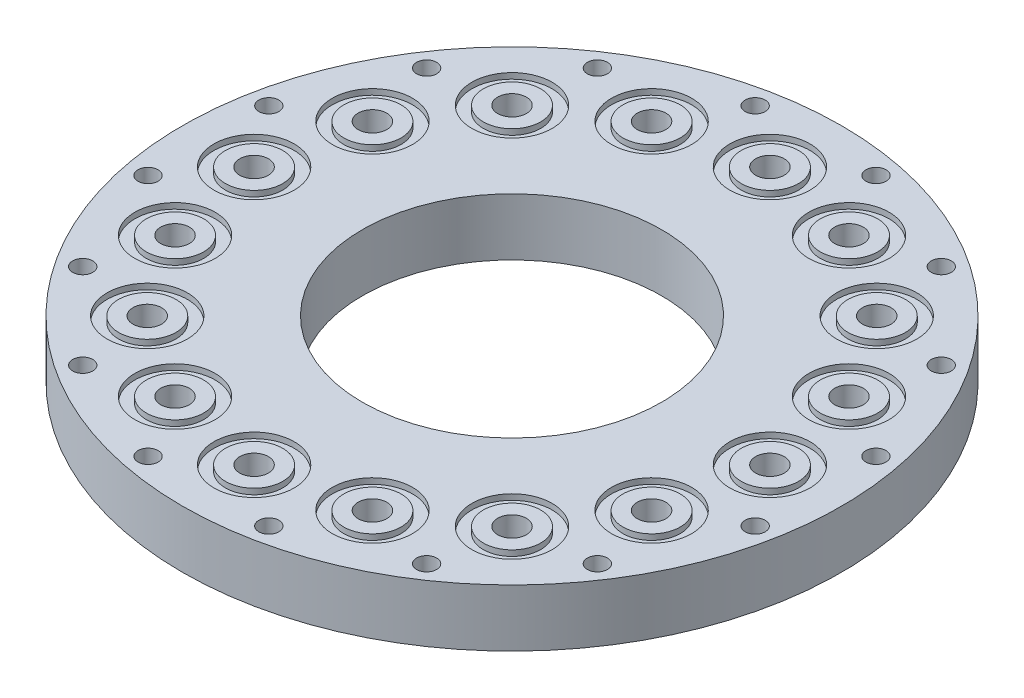
from build123d import *

# Parameters (mm, degrees)
SKETCH1_R           = 57.5
SKETCH1_R_2         = 1.75
SKETCH1_R_3         = 26.1
SKETCH1_R_4         = 2.5
BOSS_EXTRUDE1_DEPTH = 10
SKETCH2_R           = 7
SKETCH2_R_2         = 5
CUT_EXTRUDE1_DEPTH  = 1


with BuildPart() as part:
    # Sketch1 → Boss-Extrude1 (new body)
    with BuildSketch(Plane(origin=(0, 0, 0), x_dir=(1, 0, 0), z_dir=(0, 1, 0))):
        with Locations(Location((0, 0, 0), (0, 0, 270))):
            Circle(SKETCH1_R)
        with Locations(Location((-10.534877389, 52.962405142, 0), (0, 0, 270))):
            Circle(SKETCH1_R_2, mode=Mode.SUBTRACT)
        with Locations(Location((10.534877389, 52.962405142, 0), (0, 0, 270))):
            Circle(SKETCH1_R_2, mode=Mode.SUBTRACT)
        with Locations(Location((30.000792583, 44.899359064, 0), (0, 0, 270))):
            Circle(SKETCH1_R_2, mode=Mode.SUBTRACT)
        with Locations(Location((44.899359064, 30.000792583, 0), (0, 0, 270))):
            Circle(SKETCH1_R_2, mode=Mode.SUBTRACT)
        with Locations(Location((52.962405142, 10.534877389, 0), (0, 0, 270))):
            Circle(SKETCH1_R_2, mode=Mode.SUBTRACT)
        with Locations(Location((52.962405142, -10.534877389, 0), (0, 0, 270))):
            Circle(SKETCH1_R_2, mode=Mode.SUBTRACT)
        with Locations(Location((44.899359064, -30.000792583, 0), (0, 0, 270))):
            Circle(SKETCH1_R_2, mode=Mode.SUBTRACT)
        with Locations(Location((30.000792583, -44.899359064, 0), (0, 0, 270))):
            Circle(SKETCH1_R_2, mode=Mode.SUBTRACT)
        with Locations(Location((10.534877389, -52.962405142, 0), (0, 0, 270))):
            Circle(SKETCH1_R_2, mode=Mode.SUBTRACT)
        with Locations(Location((-10.534877389, -52.962405142, 0), (0, 0, 270))):
            Circle(SKETCH1_R_2, mode=Mode.SUBTRACT)
        with Locations(Location((-30.000792583, -44.899359064, 0), (0, 0, 270))):
            Circle(SKETCH1_R_2, mode=Mode.SUBTRACT)
        with Locations(Location((-44.899359064, -30.000792583, 0), (0, 0, 270))):
            Circle(SKETCH1_R_2, mode=Mode.SUBTRACT)
        with Locations(Location((0, 0, 0), (0, 0, 270))):
            Circle(SKETCH1_R_3, mode=Mode.SUBTRACT)
        with Locations(Location((0, 45, 0), (0, 0, 270))):
            Circle(SKETCH1_R_4, mode=Mode.SUBTRACT)
        with Locations(Location((17.220754456, 41.574578963, 0), (0, 0, 270))):
            Circle(SKETCH1_R_4, mode=Mode.SUBTRACT)
        with Locations(Location((31.819805153, 31.819805153, 0), (0, 0, 270))):
            Circle(SKETCH1_R_4, mode=Mode.SUBTRACT)
        with Locations(Location((41.574578963, 17.220754456, 0), (0, 0, 270))):
            Circle(SKETCH1_R_4, mode=Mode.SUBTRACT)
        with Locations(Location((45, 0, 0), (0, 0, 270))):
            Circle(SKETCH1_R_4, mode=Mode.SUBTRACT)
        with Locations(Location((41.574578963, -17.220754456, 0), (0, 0, 270))):
            Circle(SKETCH1_R_4, mode=Mode.SUBTRACT)
        with Locations(Location((31.819805153, -31.819805153, 0), (0, 0, 270))):
            Circle(SKETCH1_R_4, mode=Mode.SUBTRACT)
        with Locations(Location((17.220754456, -41.574578963, 0), (0, 0, 270))):
            Circle(SKETCH1_R_4, mode=Mode.SUBTRACT)
        with Locations(Location((0, -45, 0), (0, 0, 270))):
            Circle(SKETCH1_R_4, mode=Mode.SUBTRACT)
        with Locations(Location((-17.220754456, -41.574578963, 0), (0, 0, 270))):
            Circle(SKETCH1_R_4, mode=Mode.SUBTRACT)
        with Locations(Location((-31.819805153, -31.819805153, 0), (0, 0, 270))):
            Circle(SKETCH1_R_4, mode=Mode.SUBTRACT)
        with Locations(Location((-41.574578963, -17.220754456, 0), (0, 0, 270))):
            Circle(SKETCH1_R_4, mode=Mode.SUBTRACT)
        with Locations(Location((-45, 0, 0), (0, 0, 270))):
            Circle(SKETCH1_R_4, mode=Mode.SUBTRACT)
        with Locations(Location((-41.574578963, 17.220754456, 0), (0, 0, 270))):
            Circle(SKETCH1_R_4, mode=Mode.SUBTRACT)
        with Locations(Location((-31.819805153, 31.819805153, 0), (0, 0, 270))):
            Circle(SKETCH1_R_4, mode=Mode.SUBTRACT)
        with Locations(Location((-17.220754456, 41.574578963, 0), (0, 0, 270))):
            Circle(SKETCH1_R_4, mode=Mode.SUBTRACT)
        with Locations(Location((-52.962405142, -10.534877389, 0), (0, 0, 270))):
            Circle(SKETCH1_R_2, mode=Mode.SUBTRACT)
        with Locations(Location((-52.962405142, 10.534877389, 0), (0, 0, 270))):
            Circle(SKETCH1_R_2, mode=Mode.SUBTRACT)
        with Locations(Location((-44.899359064, 30.000792583, 0), (0, 0, 270))):
            Circle(SKETCH1_R_2, mode=Mode.SUBTRACT)
        with Locations(Location((-30.000792583, 44.899359064, 0), (0, 0, 270))):
            Circle(SKETCH1_R_2, mode=Mode.SUBTRACT)
    extrude(amount=BOSS_EXTRUDE1_DEPTH)

    # Sketch2 → Cut-Extrude1 (cut)
    # profile 1 of 16: a face of its own
    with BuildSketch(Plane(origin=(0, 10, 0), x_dir=(1, 0, 0), z_dir=(0, 1, 0))):
        with Locations(Location((0, 45, 0), (0, 0, 270))):
            Circle(SKETCH2_R)
        with Locations(Location((0, 45, 0), (0, 0, 270))):
            Circle(SKETCH2_R_2, mode=Mode.SUBTRACT)
    # profile 2 of 16: a face of its own
    with BuildSketch(Plane(origin=(0, 10, 0), x_dir=(1, 0, 0), z_dir=(0, 1, 0))):
        with Locations(Location((17.220754456, 41.574578963, 0), (0, 0, 270))):
            Circle(SKETCH2_R)
        with Locations(Location((17.220754456, 41.574578963, 0), (0, 0, 270))):
            Circle(SKETCH2_R_2, mode=Mode.SUBTRACT)
    # profile 3 of 16: a face of its own
    with BuildSketch(Plane(origin=(0, 10, 0), x_dir=(1, 0, 0), z_dir=(0, 1, 0))):
        with Locations(Location((31.819805153, 31.819805153, 0), (0, 0, 270))):
            Circle(SKETCH2_R)
        with Locations(Location((31.819805153, 31.819805153, 0), (0, 0, 270))):
            Circle(SKETCH2_R_2, mode=Mode.SUBTRACT)
    # profile 4 of 16: a face of its own
    with BuildSketch(Plane(origin=(0, 10, 0), x_dir=(1, 0, 0), z_dir=(0, 1, 0))):
        with Locations(Location((41.574578963, 17.220754456, 0), (0, 0, 270))):
            Circle(SKETCH2_R)
        with Locations(Location((41.574578963, 17.220754456, 0), (0, 0, 270))):
            Circle(SKETCH2_R_2, mode=Mode.SUBTRACT)
    # profile 5 of 16: a face of its own
    with BuildSketch(Plane(origin=(0, 10, 0), x_dir=(1, 0, 0), z_dir=(0, 1, 0))):
        with Locations(Location((45, 0, 0), (0, 0, 270))):
            Circle(SKETCH2_R)
        with Locations(Location((45, 0, 0), (0, 0, 270))):
            Circle(SKETCH2_R_2, mode=Mode.SUBTRACT)
    # profile 6 of 16: a face of its own
    with BuildSketch(Plane(origin=(0, 10, 0), x_dir=(1, 0, 0), z_dir=(0, 1, 0))):
        with Locations(Location((41.574578963, -17.220754456, 0), (0, 0, 270))):
            Circle(SKETCH2_R)
        with Locations(Location((41.574578963, -17.220754456, 0), (0, 0, 270))):
            Circle(SKETCH2_R_2, mode=Mode.SUBTRACT)
    # profile 7 of 16: a face of its own
    with BuildSketch(Plane(origin=(0, 10, 0), x_dir=(1, 0, 0), z_dir=(0, 1, 0))):
        with Locations(Location((31.819805153, -31.819805153, 0), (0, 0, 270))):
            Circle(SKETCH2_R)
        with Locations(Location((31.819805153, -31.819805153, 0), (0, 0, 270))):
            Circle(SKETCH2_R_2, mode=Mode.SUBTRACT)
    # profile 8 of 16: a face of its own
    with BuildSketch(Plane(origin=(0, 10, 0), x_dir=(1, 0, 0), z_dir=(0, 1, 0))):
        with Locations(Location((17.220754456, -41.574578963, 0), (0, 0, 270))):
            Circle(SKETCH2_R)
        with Locations(Location((17.220754456, -41.574578963, 0), (0, 0, 270))):
            Circle(SKETCH2_R_2, mode=Mode.SUBTRACT)
    # profile 9 of 16: a face of its own
    with BuildSketch(Plane(origin=(0, 10, 0), x_dir=(1, 0, 0), z_dir=(0, 1, 0))):
        with Locations(Location((0, -45, 0), (0, 0, 270))):
            Circle(SKETCH2_R)
        with Locations(Location((0, -45, 0), (0, 0, 270))):
            Circle(SKETCH2_R_2, mode=Mode.SUBTRACT)
    # profile 10 of 16: a face of its own
    with BuildSketch(Plane(origin=(0, 10, 0), x_dir=(1, 0, 0), z_dir=(0, 1, 0))):
        with Locations(Location((-17.220754456, -41.574578963, 0), (0, 0, 270))):
            Circle(SKETCH2_R)
        with Locations(Location((-17.220754456, -41.574578963, 0), (0, 0, 270))):
            Circle(SKETCH2_R_2, mode=Mode.SUBTRACT)
    # profile 11 of 16: a face of its own
    with BuildSketch(Plane(origin=(0, 10, 0), x_dir=(1, 0, 0), z_dir=(0, 1, 0))):
        with Locations(Location((-31.819805153, -31.819805153, 0), (0, 0, 270))):
            Circle(SKETCH2_R)
        with Locations(Location((-31.819805153, -31.819805153, 0), (0, 0, 270))):
            Circle(SKETCH2_R_2, mode=Mode.SUBTRACT)
    # profile 12 of 16: a face of its own
    with BuildSketch(Plane(origin=(0, 10, 0), x_dir=(1, 0, 0), z_dir=(0, 1, 0))):
        with Locations(Location((-41.574578963, -17.220754456, 0), (0, 0, 270))):
            Circle(SKETCH2_R)
        with Locations(Location((-41.574578963, -17.220754456, 0), (0, 0, 270))):
            Circle(SKETCH2_R_2, mode=Mode.SUBTRACT)
    # profile 13 of 16: a face of its own
    with BuildSketch(Plane(origin=(0, 10, 0), x_dir=(1, 0, 0), z_dir=(0, 1, 0))):
        with Locations(Location((-45, 0, 0), (0, 0, 270))):
            Circle(SKETCH2_R)
        with Locations(Location((-45, 0, 0), (0, 0, 270))):
            Circle(SKETCH2_R_2, mode=Mode.SUBTRACT)
    # profile 14 of 16: a face of its own
    with BuildSketch(Plane(origin=(0, 10, 0), x_dir=(1, 0, 0), z_dir=(0, 1, 0))):
        with Locations(Location((-41.574578963, 17.220754456, 0), (0, 0, 270))):
            Circle(SKETCH2_R)
        with Locations(Location((-41.574578963, 17.220754456, 0), (0, 0, 270))):
            Circle(SKETCH2_R_2, mode=Mode.SUBTRACT)
    # profile 15 of 16: a face of its own
    with BuildSketch(Plane(origin=(0, 10, 0), x_dir=(1, 0, 0), z_dir=(0, 1, 0))):
        with Locations(Location((-31.819805153, 31.819805153, 0), (0, 0, 270))):
            Circle(SKETCH2_R)
        with Locations(Location((-31.819805153, 31.819805153, 0), (0, 0, 270))):
            Circle(SKETCH2_R_2, mode=Mode.SUBTRACT)
    # profile 16 of 16: a face of its own
    with BuildSketch(Plane(origin=(0, 10, 0), x_dir=(1, 0, 0), z_dir=(0, 1, 0))):
        with Locations(Location((-17.220754456, 41.574578963, 0), (0, 0, 270))):
            Circle(SKETCH2_R)
        with Locations(Location((-17.220754456, 41.574578963, 0), (0, 0, 270))):
            Circle(SKETCH2_R_2, mode=Mode.SUBTRACT)
    extrude(amount=-CUT_EXTRUDE1_DEPTH, mode=Mode.SUBTRACT)


solid = part.part
